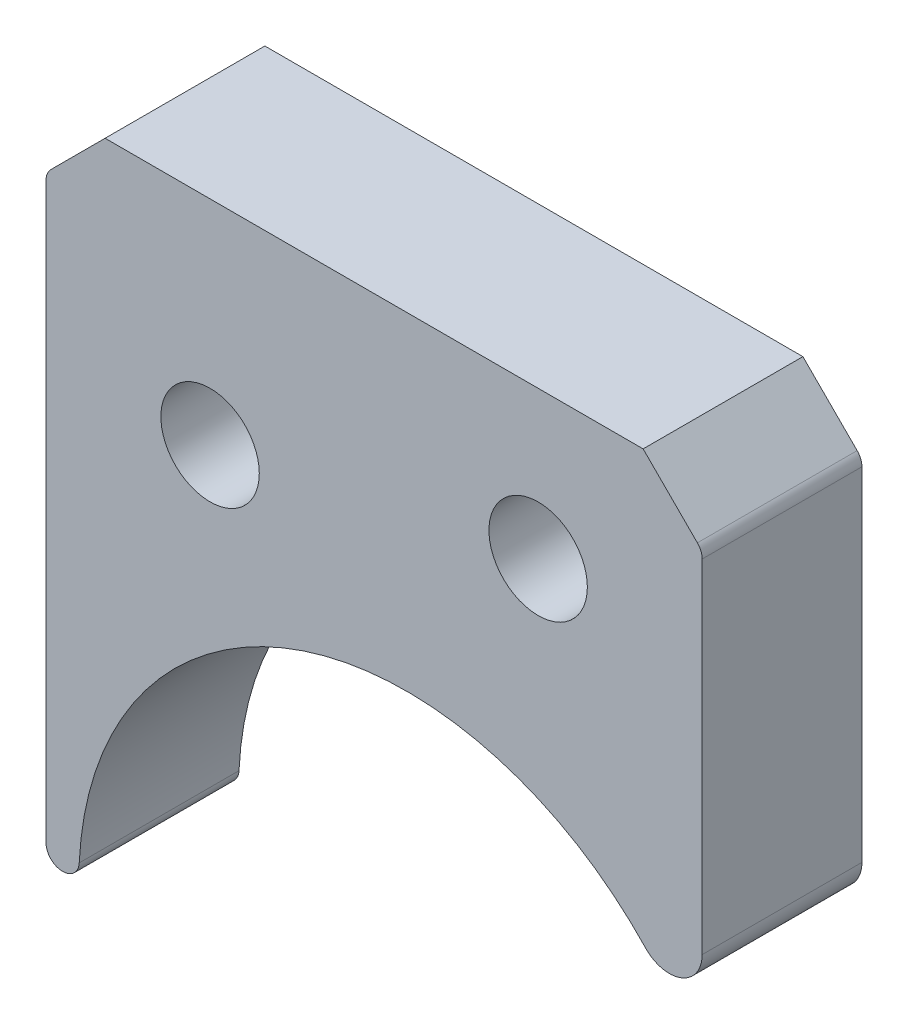
from build123d import *

# Parameters (mm, degrees)
BOSS_EXTRUDE1_DEPTH = 4.87
SKETCH2_R           = 1.5
CUT_EXTRUDE1_DEPTH  = 4.87
CHAMFER1_SIZE       = 1.8
FILLET1_R           = 0.5
FILLET2_R           = 1


with BuildPart() as part:
    # Sketch1 → Boss-Extrude1 (new body)
    with BuildSketch(Plane.XY):
        with BuildLine():
            Line((0, 0), (1, 0))
            ThreePointArc((1, 0), (8.763932023, 9.746794345), (20, 4.358898944))
            Line((20, 4.358898944), (20, 20))
            Line((20, 20), (0, 20))
            Line((0, 20), (0, 0))
        make_face()
    extrude(amount=BOSS_EXTRUDE1_DEPTH)

    # Sketch2 → Cut-Extrude1 (cut)
    with BuildSketch(Plane.XY.offset(4.87)):
        with Locations((5, 13.5)):
            Circle(SKETCH2_R)
        with Locations((15, 15.5)):
            Circle(SKETCH2_R)
    extrude(amount=-CUT_EXTRUDE1_DEPTH, mode=Mode.SUBTRACT)

    # Chamfer1
    chamfer1_edges = [part.edges().sort_by_distance(p)[0] for p in [
        (0, 20, 2.435),
        (20, 20, 2.435),
    ]]
    chamfer(chamfer1_edges, length=CHAMFER1_SIZE)

    # Fillet1
    fillet1_edges = [part.edges().sort_by_distance(p)[0] for p in [
        (0, 18.2, 2.435),
        (20, 18.2, 2.435),
        (1, 0, 2.435),
        (0, 0, 2.435),
    ]]
    fillet(fillet1_edges, radius=FILLET1_R)

    # Fillet2
    fillet2_edges = [part.edges().sort_by_distance(p)[0] for p in [
        (20, 4.358898944, 2.435),
    ]]
    fillet(fillet2_edges, radius=FILLET2_R)


solid = part.part
